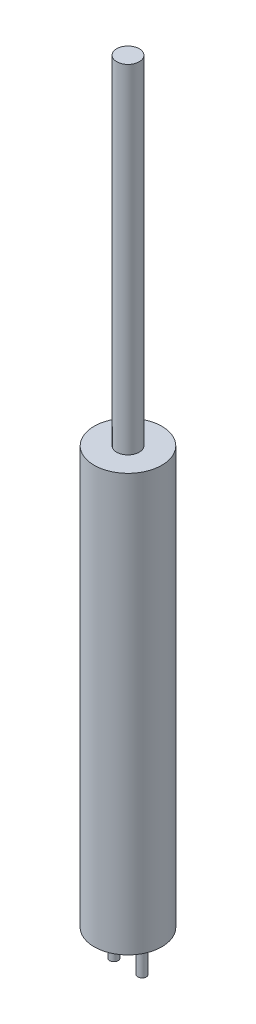
from build123d import *

# Parameters (mm, degrees)
SKETCH1_R   = 0.75
PIN_1_DEPTH = 6
SKETCH2_R   = 0.75
PIN_2_DEPTH = 6
BODY_START  = 6
SKETCH3_R   = 6
BODY_DEPTH  = 74
CABLE_START = 80
SKETCH4_R   = 2
CABLE_DEPTH = 60


with BuildPart() as part:
    # Sketch1 → Pin_1 (new body)
    with BuildSketch(Plane(origin=(0, 0, 0), x_dir=(1, 0, 0), z_dir=(0, 1, 0))):
        with Locations(Location((-2.5, 0, 0), (0, 0, 270))):
            Circle(SKETCH1_R)
    extrude(amount=PIN_1_DEPTH)



with BuildPart() as body_2:
    # Sketch2 → Pin_2 (new body)
    with BuildSketch(Plane(origin=(0, 0, 0), x_dir=(1, 0, 0), z_dir=(0, 1, 0))):
        with Locations(Location((2.5, 0, 0), (0, 0, 270))):
            Circle(SKETCH2_R)
    extrude(amount=PIN_2_DEPTH)


with BuildPart() as part_1:
    add(part.part)

    add(body_2.part)  # Body merges body 2
    # Sketch3 → Body (add)
    with BuildSketch(Plane(origin=(0, 0, 0), x_dir=(1, 0, 0), z_dir=(0, 1, 0)).offset(BODY_START)):
        with Locations(Location((0, 0, 0), (0, 0, 270))):
            Circle(SKETCH3_R)
    extrude(amount=BODY_DEPTH)

    # Sketch4 → Cable (add)
    with BuildSketch(Plane(origin=(0, 0, 0), x_dir=(1, 0, 0), z_dir=(0, 1, 0)).offset(CABLE_START)):
        with Locations(Location((0, 0, 0), (0, 0, 270))):
            Circle(SKETCH4_R)
    extrude(amount=CABLE_DEPTH)


solid = part_1.part
